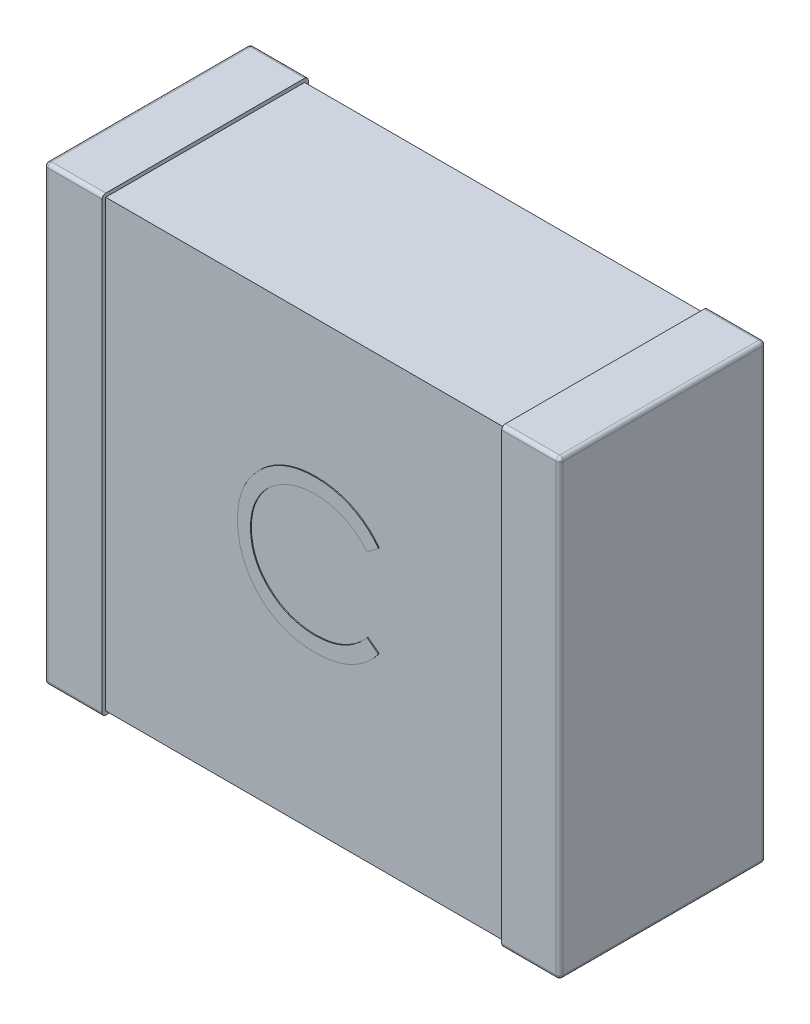
from build123d import *

# Parameters (mm, degrees)
EXTRUDE_1_DEPTH        = 2.24
EXTRUDE_1_DEPTH_BACK   = 0.04
SKETCH_3_W             = 0.64
SKETCH_3_H             = 5
EXTRUDE_1_2_DEPTH      = 2.24
EXTRUDE_1_2_DEPTH_BACK = 0.04
SKETCH_5_W             = 2.2
SKETCH_5_H             = 4.92
EXTRUDE_3_DEPTH        = 2.26
FILLET_3_R             = 0.04
EXTRUDE_4_DEPTH        = 0.01


with BuildPart() as part:
    # 草图3 → 凸台-拉伸1 (new, two sides: drawn at the far end of the back side and taken through both)
    with BuildSketch(Plane.XY.offset(-EXTRUDE_1_DEPTH_BACK)):
        with Locations((-2.53, 0)):
            Rectangle(SKETCH_3_W, SKETCH_3_H)
    extrude(amount=EXTRUDE_1_DEPTH + EXTRUDE_1_DEPTH_BACK)



with BuildPart() as body_2:
    # 草图3 → Extrude 1 2 (new, two sides: drawn at the far end of the back side and taken through both)
    with BuildSketch(Plane.XY.offset(-EXTRUDE_1_2_DEPTH_BACK)):
        with Locations((2.53, 0)):
            Rectangle(SKETCH_3_W, SKETCH_3_H)
    extrude(amount=EXTRUDE_1_2_DEPTH + EXTRUDE_1_2_DEPTH_BACK)


with BuildPart() as part_1:
    add(part.part)

    add(body_2.part)  # 凸台-拉伸3 merges body 2
    # 草图5 → 凸台-拉伸3 (add, symmetric)
    with BuildSketch(Plane(origin=(0, 0, 0), x_dir=(0, 0, -1), z_dir=(1, 0, 0))):
        with Locations((-1.1, 0)):
            Rectangle(SKETCH_5_W, SKETCH_5_H)
    extrude(amount=EXTRUDE_3_DEPTH, both=True)

    # 圆角3
    fillet_3_edges = [part_1.edges().sort_by_distance(p)[0] for p in [
        (-2.85, 0, -0.04),
        (-2.53, 2.5, 2.24),
        (-2.53, -2.5, -0.04),
        (-2.85, 0, 2.24),
        (-2.53, -2.5, 2.24),
        (2.85, 2.5, 1.1),
        (2.85, 0, -0.04),
        (2.85, -2.5, 1.1),
        (2.53, -2.5, -0.04),
        (2.53, 2.5, -0.04),
        (2.85, 0, 2.24),
        (2.53, 2.5, 2.24),
        (2.53, -2.5, 2.24),
        (-2.53, 2.5, -0.04),
        (-2.85, -2.5, 1.1),
        (-2.85, 2.5, 1.1),
    ]]
    fillet(fillet_3_edges, radius=FILLET_3_R)

    # 草图6 → 凸台-拉伸4 (add)
    with BuildSketch(Plane.XY.offset(2.2)):
        with BuildLine():
            Line((0.816058378, 0.613216546), (0.690417352, 0.5170627))
            add(Edge.make_bspline(
                [(0.690417352, 0.5170627), (0.681454661, 0.527744286), (0.663650113, 0.548963447), (0.635005907, 0.578759811), (0.605153727, 0.606675359), (0.574104986, 0.632843075), (0.541300817, 0.656347882), (0.50753588, 0.678414672), (0.472245345, 0.69819421), (0.423444553, 0.722177289), (0.359605536, 0.747204103), (0.279242181, 0.768188437), (0.195351393, 0.781546689), (0.138118205, 0.782993473), (0.109007096, 0.783729366)],
                knots=[0, 0, 0, 0, 0.757959112, 1.505699292, 2.245454638, 2.979532153, 3.711538275, 4.438200793, 5.171680507, 5.909471876, 7.393775596, 8.890124382, 10.418191784, 12, 12, 12, 12], degree=3))
            add(Edge.make_bspline(
                [(0.109007096, 0.783729366), (0.092969016, 0.783544698), (0.061041705, 0.783177075), (0.013659546, 0.778327189), (-0.032837849, 0.771510636), (-0.078420233, 0.761396202), (-0.123029586, 0.748608719), (-0.166957541, 0.73332853), (-0.209568101, 0.71442346), (-0.251450724, 0.693528256), (-0.291578363, 0.669927138), (-0.329546385, 0.644183892), (-0.365216313, 0.61658659), (-0.398616365, 0.587031799), (-0.429780684, 0.555652617), (-0.458483455, 0.522114632), (-0.484625356, 0.486525067), (-0.508724568, 0.449353224), (-0.530307532, 0.410707376), (-0.548378334, 0.370444487), (-0.564380675, 0.32925404), (-0.577043186, 0.286670652), (-0.587065822, 0.242993959), (-0.593981326, 0.198106742), (-0.598776055, 0.152102774), (-0.59914185, 0.120921374), (-0.599326237, 0.105203725)],
                knots=[0, 0, 0, 0, 1.054917814, 2.100044995, 3.131103042, 4.146048494, 5.169673617, 6.183595914, 7.203665975, 8.234915748, 9.262203917, 10.264457458, 11.251630812, 12.227803204, 13.197192746, 14.159520551, 15.12972552, 16.100847026, 17.073214652, 18.039054194, 19.002613845, 19.979014051, 20.95965708, 21.949030935, 22.966165397, 24, 24, 24, 24], degree=3))
            add(Edge.make_bspline(
                [(-0.599326237, 0.105203725), (-0.598749406, 0.081555122), (-0.597616874, 0.035124226), (-0.587537635, -0.032885196), (-0.572221022, -0.098037504), (-0.54926533, -0.159925432), (-0.520959478, -0.21931211), (-0.485192341, -0.275192728), (-0.443767638, -0.328411729), (-0.396099332, -0.377711363), (-0.343799531, -0.422746208), (-0.2876862, -0.462403617), (-0.227899097, -0.495461849), (-0.165098352, -0.522970853), (-0.0988007, -0.544116786), (-0.029125361, -0.559003242), (0.043776122, -0.568713953), (0.093590705, -0.569643639), (0.118942993, -0.570116787)],
                knots=[0, 0, 0, 0, 1.029171465, 2.020641659, 2.987623507, 3.938342917, 4.889210282, 5.84687017, 6.821220943, 7.821438502, 8.827599549, 9.822697543, 10.807740252, 11.797342354, 12.80366471, 13.83203677, 14.896651826, 16, 16, 16, 16], degree=3))
            add(Edge.make_bspline(
                [(0.118942993, -0.570116787), (0.146875651, -0.569344774), (0.201853804, -0.567825266), (0.282479187, -0.554952467), (0.359661252, -0.534080276), (0.433404148, -0.504869797), (0.503499987, -0.466897094), (0.57005846, -0.420863779), (0.633135749, -0.366331969), (0.671065478, -0.324693968), (0.690417352, -0.303450121)],
                knots=[0, 0, 0, 0, 1.028121516, 2.023589091, 2.998037872, 3.967518031, 4.937445131, 5.927275754, 6.942489185, 8, 8, 8, 8], degree=3))
            Line((0.690417352, -0.303450121), (0.816058378, -0.398642428))
            add(Edge.make_bspline(
                [(0.816058378, -0.398642428), (0.805947242, -0.411688578), (0.785773402, -0.437718386), (0.75310688, -0.474414025), (0.718694401, -0.508930156), (0.682280362, -0.540988497), (0.644283658, -0.571230538), (0.604022029, -0.59879709), (0.562024757, -0.624072923), (0.518434138, -0.647216659), (0.473296487, -0.667750258), (0.426665888, -0.685329123), (0.378743339, -0.70047193), (0.329526649, -0.712929958), (0.278913732, -0.722653882), (0.22708723, -0.729154305), (0.173935287, -0.733607752), (0.138076351, -0.734013656), (0.119904532, -0.734219352)],
                knots=[0, 0, 0, 0, 0.986787822, 1.968848986, 2.935600012, 3.899624008, 4.868462664, 5.837806735, 6.815139263, 7.798259679, 8.787526145, 9.778297419, 10.776456485, 11.791383307, 12.812564526, 13.85620153, 14.913611965, 16, 16, 16, 16], degree=3))
            add(Edge.make_bspline(
                [(0.119904532, -0.734219352), (0.102695998, -0.734099583), (0.068668254, -0.733862757), (0.018428825, -0.730026338), (-0.030480698, -0.724792172), (-0.077920527, -0.716910969), (-0.124149544, -0.7076107), (-0.168748668, -0.69514384), (-0.212156764, -0.681178506), (-0.254199434, -0.664764798), (-0.29491244, -0.646243115), (-0.334164468, -0.62530983), (-0.371937466, -0.602140978), (-0.408602801, -0.577247259), (-0.443618839, -0.549829064), (-0.477289022, -0.520267174), (-0.509802154, -0.488661226), (-0.529917667, -0.465870436), (-0.540031366, -0.454411659)],
                knots=[0, 0, 0, 0, 1.114604814, 2.203992996, 3.262667896, 4.300477797, 5.318619304, 6.316056647, 7.298880507, 8.271930387, 9.238335007, 10.195173496, 11.151986948, 12.108099108, 13.064862484, 14.031167946, 15.010108607, 16, 16, 16, 16], degree=3))
            add(Edge.make_bspline(
                [(-0.540031366, -0.454411659), (-0.556230517, -0.434507116), (-0.588433249, -0.394938334), (-0.629633562, -0.3308076), (-0.664901015, -0.263850704), (-0.693415722, -0.193715879), (-0.715707257, -0.120560502), (-0.731150089, -0.044347696), (-0.741185108, 0.034851363), (-0.742332669, 0.08871961), (-0.742915981, 0.116101161)],
                knots=[0, 0, 0, 0, 0.994628077, 1.977248131, 2.950237994, 3.925870899, 4.908910175, 5.911660606, 6.938484602, 8, 8, 8, 8], degree=3))
            add(Edge.make_bspline(
                [(-0.742915981, 0.116101161), (-0.742205035, 0.144880797), (-0.740806294, 0.201502934), (-0.728922502, 0.284599599), (-0.709805338, 0.364211667), (-0.682652475, 0.440190521), (-0.648227171, 0.512935792), (-0.605700719, 0.581891772), (-0.555567168, 0.647499451), (-0.498219709, 0.708763338), (-0.435331784, 0.764781327), (-0.367986041, 0.814064163), (-0.296314293, 0.855077885), (-0.221106133, 0.889361845), (-0.141798393, 0.9157136), (-0.058560281, 0.934160771), (0.028451794, 0.945642881), (0.087817475, 0.947094405), (0.117981455, 0.947831931)],
                knots=[0, 0, 0, 0, 1.032925535, 2.032216505, 3.007276963, 3.968222605, 4.92396291, 5.891752235, 6.871517503, 7.883894988, 8.900124299, 9.891468569, 10.874487609, 11.85992873, 12.854644235, 13.869047385, 14.917252991, 16, 16, 16, 16], degree=3))
            add(Edge.make_bspline(
                [(0.117981455, 0.947831931), (0.136365214, 0.947611525), (0.172754012, 0.947175253), (0.226583796, 0.942921017), (0.278991717, 0.935829082), (0.33001388, 0.926176022), (0.379898505, 0.914195532), (0.428264329, 0.898588538), (0.475395158, 0.880743267), (0.520993744, 0.860190825), (0.56484131, 0.837120315), (0.606924198, 0.811787459), (0.646908134, 0.784223662), (0.685074465, 0.754663353), (0.720784733, 0.722481155), (0.755052837, 0.688562254), (0.786715044, 0.651929648), (0.806259362, 0.626144536), (0.816058378, 0.613216546)],
                knots=[0, 0, 0, 0, 1.096760587, 2.17092713, 3.219439832, 4.250915756, 5.268269357, 6.278326846, 7.281116186, 8.274029601, 9.260640565, 10.235837813, 11.203064059, 12.156899882, 13.114053108, 14.069676657, 15.032185724, 16, 16, 16, 16], degree=3))
        make_face()
    extrude(amount=EXTRUDE_4_DEPTH)


solid = part_1.part
